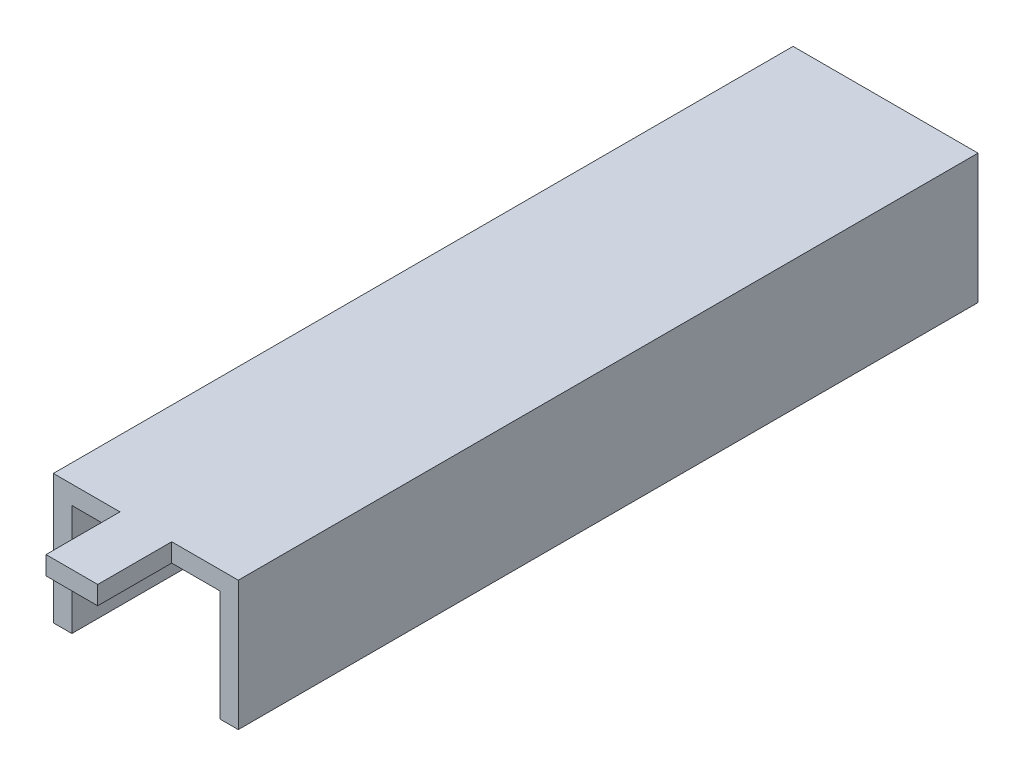
from build123d import *

# Parameters (mm, degrees)
BOSS_EXTRUDE1_DEPTH = 254
SKETCH2_W           = 17.759293508
SKETCH2_H           = 6.35
BOSS_EXTRUDE2_DEPTH = 25.4


with BuildPart() as part:
    # Sketch1 → Boss-Extrude1 (new body)
    with BuildSketch(Plane.XY):
        Polygon((0, 0), (6.35, 0), (6.35, 38.1), (57.15, 38.1), (57.15, 0), (63.5, 0), (63.5, 44.45), (57.15, 44.45), (6.35, 44.45), (0, 44.45), align=None)
    extrude(amount=BOSS_EXTRUDE1_DEPTH)

    # Sketch2 → Boss-Extrude2 (add)
    with BuildSketch(Plane.XY.offset(254)):
        with Locations((31.75, 41.275)):
            Rectangle(SKETCH2_W, SKETCH2_H)
    extrude(amount=BOSS_EXTRUDE2_DEPTH)


solid = part.part
